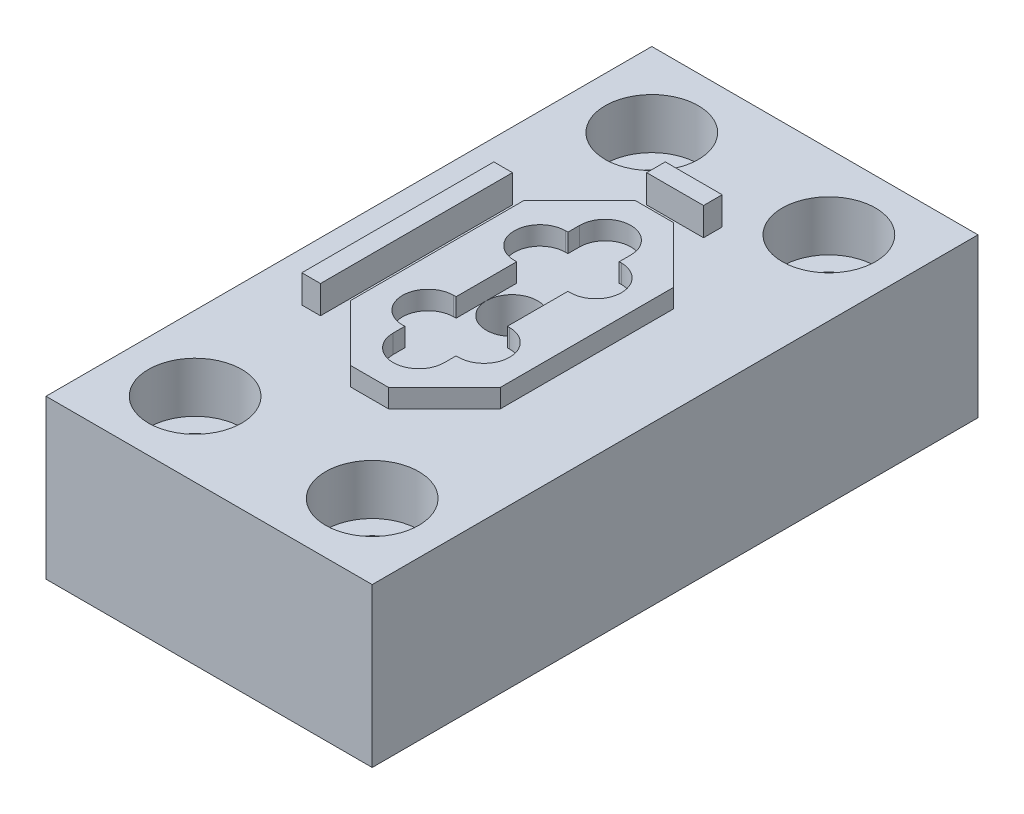
from build123d import *

# Parameters (mm, degrees)
SKIZZE1_W                                            = 35
SKIZZE1_H                                            = 65
AUFSATZ_LINEAR_AUSTRAGEN1_DEPTH                      = 20
SKIZZE4_W                                            = 20.5
SKIZZE4_H                                            = 35
SCHNITT_LINEAR_AUSTRAGEN3_DEPTH                      = 1
SKIZZE6_W                                            = 2.2
SKIZZE6_H                                            = 65
SCHNITT_LINEAR_AUSTRAGEN4_DEPTH                      = 3
SKIZZE7_W                                            = 35
SKIZZE7_H                                            = 2.2
SCHNITT_LINEAR_AUSTRAGEN5_DEPTH                      = 3
SKIZZE8_W                                            = 7.25
SKIZZE8_H                                            = 15
SKIZZE8_W_2                                          = 5.25
SKIZZE8_H_2                                          = 30.6
SKIZZE8_W_3                                          = 16.1
SKIZZE8_H_3                                          = 13
SCHNITT_LINEAR_AUSTRAGEN6_DEPTH                      = 3
SKIZZE9_W                                            = 5.5
SKIZZE9_H                                            = 5.5
SKIZZE9_H_2                                          = 6.5
SCHNITT_LINEAR_AUSTRAGEN7_DEPTH                      = 2
SKIZZE10_R                                           = 2.75
SCHNITT_LINEAR_AUSTRAGEN8_DEPTH                      = 14
KERNLOCH_F_R_M5_GEWINDE1_D                           = 4.2
KERNLOCH_F_R_M5_GEWINDE1_DEPTH                       = 35
KERNLOCH_F_R_M5_GEWINDE1_TIP                         = 1.2618073
SKIZZE17_W                                           = 2
SKIZZE17_H                                           = 5
SKIZZE17_W_2                                         = 5
SKIZZE17_H_2                                         = 2
SCHNITT_LINEAR_AUSTRAGEN11_DEPTH                     = 3
FASE1_SIZE                                           = 6
STIRNSENKUNG_F_R_M5_ZYLINDERSCHRAUBE_MIT_D           = 5.5
STIRNSENKUNG_F_R_M5_ZYLINDERSCHRAUBE_MIT_CBORE_D     = 10
STIRNSENKUNG_F_R_M5_ZYLINDERSCHRAUBE_MIT_CBORE_DEPTH = 5.4


with BuildPart() as part:
    # Skizze1 → Aufsatz-Linear austragen1 (new body)
    with BuildSketch(Plane(origin=(0, 0, 0), x_dir=(1, 0, 0), z_dir=(0, 1, 0))):
        Rectangle(SKIZZE1_W, SKIZZE1_H)
    extrude(amount=AUFSATZ_LINEAR_AUSTRAGEN1_DEPTH)

    # Skizze4 → Schnitt-Linear austragen3 (cut)
    with BuildSketch(Plane(origin=(0, 20, 0), x_dir=(1, 0, 0), z_dir=(0, 1, 0))):
        Rectangle(SKIZZE4_W, SKIZZE4_H)
    extrude(amount=-SCHNITT_LINEAR_AUSTRAGEN3_DEPTH, mode=Mode.SUBTRACT)

    # Skizze6 → Schnitt-Linear austragen4 (cut)
    with BuildSketch(Plane(origin=(0, 20, 0), x_dir=(1, 0, 0), z_dir=(0, 1, 0))):
        with Locations((9.15, 0)):
            Rectangle(SKIZZE6_W, SKIZZE6_H)
        with Locations((-9.15, 0)):
            Rectangle(SKIZZE6_W, SKIZZE6_H)
    extrude(amount=-SCHNITT_LINEAR_AUSTRAGEN4_DEPTH, mode=Mode.SUBTRACT)

    # Skizze7 → Schnitt-Linear austragen5 (cut)
    with BuildSketch(Plane(origin=(0, 20, 0), x_dir=(1, 0, 0), z_dir=(0, 1, 0))):
        with Locations((0, 16.4)):
            Rectangle(SKIZZE7_W, SKIZZE7_H)
        with Locations((0, -16.4)):
            Rectangle(SKIZZE7_W, SKIZZE7_H)
    extrude(amount=-SCHNITT_LINEAR_AUSTRAGEN5_DEPTH, mode=Mode.SUBTRACT)

    # Skizze8 → Schnitt-Linear austragen6 (cut)
    with BuildSketch(Plane(origin=(0, 20, 0), x_dir=(1, 0, 0), z_dir=(0, 1, 0))):
        with Locations((13.875, 25)):
            Rectangle(SKIZZE8_W, SKIZZE8_H)
        with Locations((13.875, -25)):
            Rectangle(SKIZZE8_W, SKIZZE8_H)
        with Locations((-13.875, -25)):
            Rectangle(SKIZZE8_W, SKIZZE8_H)
        with Locations((-13.875, 25)):
            Rectangle(SKIZZE8_W, SKIZZE8_H)
        with Locations((-14.875, 0)):
            Rectangle(SKIZZE8_W_2, SKIZZE8_H_2)
        with Locations((0, -25)):
            Rectangle(SKIZZE8_W_3, SKIZZE8_H)
        with Locations((13.875, 0)):
            Rectangle(SKIZZE8_W, SKIZZE8_H_2)
        with Locations((0, 26)):
            Rectangle(SKIZZE8_W_3, SKIZZE8_H_3)
    extrude(amount=-SCHNITT_LINEAR_AUSTRAGEN6_DEPTH, mode=Mode.SUBTRACT)

    # Skizze9 → Schnitt-Linear austragen7 (cut)
    with BuildSketch(Plane(origin=(0, 19, 0), x_dir=(1, 0, 0), z_dir=(0, 1, 0))):
        with Locations((0, 6)):
            Rectangle(SKIZZE9_W, SKIZZE9_H)
        Rectangle(SKIZZE9_W, SKIZZE9_H_2)
        with Locations((0, -6)):
            Rectangle(SKIZZE9_W, SKIZZE9_H)
        with BuildLine():
            Line((2.75, -10), (2.75, -8.75))
            Line((2.75, -8.75), (-2.75, -8.75))
            Line((-2.75, -8.75), (-2.75, -10))
            ThreePointArc((-2.75, -10), (0, -12.75), (2.75, -10))
        make_face()
        with BuildLine():
            Line((3, -3.25), (2.75, -3.25))
            Line((2.75, -3.25), (2.75, -8.75))
            Line((2.75, -8.75), (3, -8.75))
            ThreePointArc((3, -8.75), (5.75, -6), (3, -3.25))
        make_face()
        with BuildLine():
            Line((-2.75, -8.75), (-2.75, -3.25))
            Line((-2.75, -3.25), (-3, -3.25))
            ThreePointArc((-3, -3.25), (-5.75, -6), (-3, -8.75))
            Line((-3, -8.75), (-2.75, -8.75))
        make_face()
        with BuildLine():
            Line((-2.75, 3.25), (-2.75, 8.75))
            Line((-2.75, 8.75), (-3, 8.75))
            ThreePointArc((-3, 8.75), (-5.75, 6), (-3, 3.25))
            Line((-3, 3.25), (-2.75, 3.25))
        make_face()
        with BuildLine():
            Line((3, 8.75), (2.75, 8.75))
            Line((2.75, 8.75), (2.75, 3.25))
            Line((2.75, 3.25), (3, 3.25))
            ThreePointArc((3, 3.25), (5.75, 6), (3, 8.75))
        make_face()
        with BuildLine():
            Line((2.75, 8.75), (2.75, 10))
            ThreePointArc((2.75, 10), (0, 12.75), (-2.75, 10))
            Line((-2.75, 10), (-2.75, 8.75))
            Line((-2.75, 8.75), (2.75, 8.75))
        make_face()
    extrude(amount=-SCHNITT_LINEAR_AUSTRAGEN7_DEPTH, mode=Mode.SUBTRACT)

    # Skizze10 → Schnitt-Linear austragen8 (cut)
    with BuildSketch(Plane(origin=(0, 20, 0), x_dir=(1, 0, 0), z_dir=(0, 1, 0))):
        with Locations(Location((0, 0, 0), (0, 0, 270))):
            Circle(SKIZZE10_R)
    extrude(amount=-SCHNITT_LINEAR_AUSTRAGEN8_DEPTH, mode=Mode.SUBTRACT)

    # Kernloch für M5 Gewinde1
    with Locations(Plane(origin=(0, 0, -32.5), x_dir=(-1, 0, 0), z_dir=(0, 0, -1))):
        with Locations((0, 7)):
            Hole(KERNLOCH_F_R_M5_GEWINDE1_D / 2, depth=KERNLOCH_F_R_M5_GEWINDE1_DEPTH)
            with Locations((0, 0, -(KERNLOCH_F_R_M5_GEWINDE1_DEPTH + KERNLOCH_F_R_M5_GEWINDE1_TIP / 2))):  # 118° drill point
                Cone(0, KERNLOCH_F_R_M5_GEWINDE1_D / 2, KERNLOCH_F_R_M5_GEWINDE1_TIP, mode=Mode.SUBTRACT)

    # Skizze17 → Schnitt-Linear austragen11 (cut)
    with BuildSketch(Plane(origin=(0, 20, 0), x_dir=(1, 0, 0), z_dir=(0, 1, 0))):
        with Locations((-11.25, -12.8)):
            Rectangle(SKIZZE17_W, SKIZZE17_H)
        with Locations((-11.25, 12.8)):
            Rectangle(SKIZZE17_W, SKIZZE17_H)
        with Locations((-5.55, 18.5)):
            Rectangle(SKIZZE17_W_2, SKIZZE17_H_2)
        with Locations((5.55, 18.5)):
            Rectangle(SKIZZE17_W_2, SKIZZE17_H_2)
    extrude(amount=-SCHNITT_LINEAR_AUSTRAGEN11_DEPTH, mode=Mode.SUBTRACT)

    # Fase1
    fase1_edges = [part.edges().sort_by_distance(p)[0] for p in [
        (-8.05, 18, -15.3),
        (8.05, 18, -15.3),
        (-8.05, 18, 15.3),
        (8.05, 18, 15.3),
    ]]
    chamfer(fase1_edges, length=FASE1_SIZE)

    # Stirnsenkung für M5 Zylinderschraube mit Innensechskant1 (through all)
    with Locations(Plane(origin=(78.125902763, 17, -61.744554923), x_dir=(1, 0, 0), z_dir=(0, 1, 0))):
        with Locations((-68.625902763, -37.244554923), (-87.625902763, -37.244554923), (-87.625902763, -86.244554923), (-68.625902763, -86.244554923)):
            CounterBoreHole(STIRNSENKUNG_F_R_M5_ZYLINDERSCHRAUBE_MIT_D / 2, STIRNSENKUNG_F_R_M5_ZYLINDERSCHRAUBE_MIT_CBORE_D / 2, STIRNSENKUNG_F_R_M5_ZYLINDERSCHRAUBE_MIT_CBORE_DEPTH)


solid = part.part
